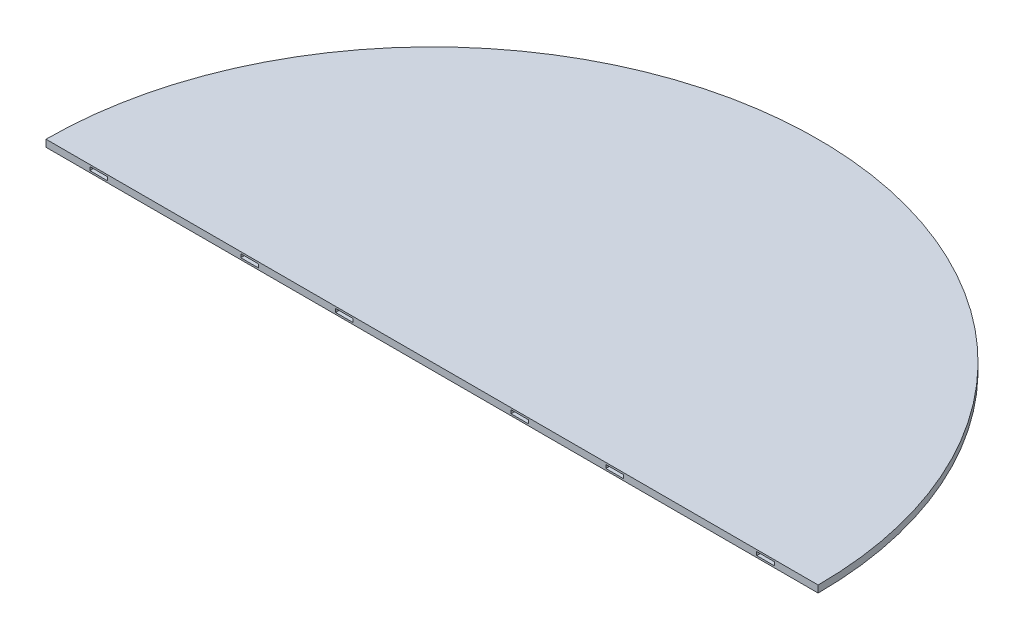
from build123d import *

# Parameters (mm, degrees)
BOSS_EXTRU_1_DEPTH                 = 20
CUSTOM_TUBE_CARRE_30_2_1_DEPTH     = 300.5
CUSTOM_TUBE_CARRE_30_2_1_2_DEPTH   = 300.5
CUSTOM_TUBE_CARRE_30_2_1_3_DEPTH   = 300.5
CUSTOM_TUBE_CARRE_35_2_5_1_DEPTH   = 350
CUSTOM_TUBE_CARRE_35_2_5_1_2_DEPTH = 350
CUSTOM_TUBE_CARRE_35_2_5_1_3_DEPTH = 350
ESQUISSE113_W                      = 50
ESQUISSE113_H                      = 10
ENL_V_MAT_EXTRU_1_DEPTH            = 10


with BuildPart() as part:
    # Esquisse1 → Boss.-Extru.1 (new body)
    with BuildSketch(Plane(origin=(0, 0, 0), x_dir=(1, 0, 0), z_dir=(0, 1, 0))):
        with BuildLine():
            Line((-1100, 0), (1100, 0))
            ThreePointArc((1100, 0), (0, 1100), (-1100, 0))
        make_face()
    extrude(amount=BOSS_EXTRU_1_DEPTH)

    # Esquisse113 → Enlèv. mat.-Extru.1 (cut)
    with BuildSketch(Plane.XY):
        with Locations((-950, 10)):
            Rectangle(ESQUISSE113_W, ESQUISSE113_H)
        with Locations((-520, 10)):
            Rectangle(ESQUISSE113_W, ESQUISSE113_H)
        with Locations((-250, 10)):
            Rectangle(ESQUISSE113_W, ESQUISSE113_H)
        with Locations((250, 10)):
            Rectangle(ESQUISSE113_W, ESQUISSE113_H)
        with Locations((520, 10)):
            Rectangle(ESQUISSE113_W, ESQUISSE113_H)
        with Locations((950, 10)):
            Rectangle(ESQUISSE113_W, ESQUISSE113_H)
    extrude(amount=-ENL_V_MAT_EXTRU_1_DEPTH, mode=Mode.SUBTRACT)


with BuildPart() as body_2:
    # Esquisse17 → Custom TUBE-CARRE-30-2(1) (new body)
    with BuildSketch(Plane(origin=(-601, -17.5, -560.75), x_dir=(-1, 0, 0), z_dir=(0, 0, 1))):
        with BuildLine():
            Line((-13, -15), (13, -15))
            ThreePointArc((13, -15), (14.414213562, -14.414213562), (15, -13))
            Line((15, -13), (15, 13))
            ThreePointArc((15, 13), (14.414213562, 14.414213562), (13, 15))
            Line((13, 15), (-13, 15))
            ThreePointArc((-13, 15), (-14.414213562, 14.414213562), (-15, 13))
            Line((-15, 13), (-15, -13))
            ThreePointArc((-15, -13), (-14.414213562, -14.414213562), (-13, -15))
        make_face()
        with BuildLine():
            Line((-11, -13), (11, -13))
            ThreePointArc((11, -13), (12.414213562, -12.414213562), (13, -11))
            Line((13, -11), (13, 11))
            ThreePointArc((13, 11), (12.414213562, 12.414213562), (11, 13))
            Line((11, 13), (-11, 13))
            ThreePointArc((-11, 13), (-12.414213562, 12.414213562), (-13, 11))
            Line((-13, 11), (-13, -11))
            ThreePointArc((-13, -11), (-12.414213562, -12.414213562), (-11, -13))
        make_face(mode=Mode.SUBTRACT)
    extrude(amount=CUSTOM_TUBE_CARRE_30_2_1_DEPTH)


with BuildPart() as body_3:
    # Esquisse17 on segment 2 (carried to segment 2) → Custom TUBE-CARRE-30-2_1 2 (new body)
    with BuildSketch(Plane(origin=(0, -17.5, -560.75), x_dir=(-1, 0, 0), z_dir=(0, 0, 1))):
        with BuildLine():
            Line((-13, -15), (13, -15))
            ThreePointArc((13, -15), (14.414213562, -14.414213562), (15, -13))
            Line((15, -13), (15, 13))
            ThreePointArc((15, 13), (14.414213562, 14.414213562), (13, 15))
            Line((13, 15), (-13, 15))
            ThreePointArc((-13, 15), (-14.414213562, 14.414213562), (-15, 13))
            Line((-15, 13), (-15, -13))
            ThreePointArc((-15, -13), (-14.414213562, -14.414213562), (-13, -15))
        make_face()
        with BuildLine():
            Line((-11, -13), (11, -13))
            ThreePointArc((11, -13), (12.414213562, -12.414213562), (13, -11))
            Line((13, -11), (13, 11))
            ThreePointArc((13, 11), (12.414213562, 12.414213562), (11, 13))
            Line((11, 13), (-11, 13))
            ThreePointArc((-11, 13), (-12.414213562, 12.414213562), (-13, 11))
            Line((-13, 11), (-13, -11))
            ThreePointArc((-13, -11), (-12.414213562, -12.414213562), (-11, -13))
        make_face(mode=Mode.SUBTRACT)
    extrude(amount=CUSTOM_TUBE_CARRE_30_2_1_2_DEPTH)


with BuildPart() as body_4:
    # Esquisse17 on segment 3 (carried to segment 3) → Custom TUBE-CARRE-30-2_1 3 (new body)
    with BuildSketch(Plane(origin=(601, -17.5, -560.75), x_dir=(-1, 0, 0), z_dir=(0, 0, 1))):
        with BuildLine():
            Line((-13, -15), (13, -15))
            ThreePointArc((13, -15), (14.414213562, -14.414213562), (15, -13))
            Line((15, -13), (15, 13))
            ThreePointArc((15, 13), (14.414213562, 14.414213562), (13, 15))
            Line((13, 15), (-13, 15))
            ThreePointArc((-13, 15), (-14.414213562, 14.414213562), (-15, 13))
            Line((-15, 13), (-15, -13))
            ThreePointArc((-15, -13), (-14.414213562, -14.414213562), (-13, -15))
        make_face()
        with BuildLine():
            Line((-11, -13), (11, -13))
            ThreePointArc((11, -13), (12.414213562, -12.414213562), (13, -11))
            Line((13, -11), (13, 11))
            ThreePointArc((13, 11), (12.414213562, 12.414213562), (11, 13))
            Line((11, 13), (-11, 13))
            ThreePointArc((-11, 13), (-12.414213562, 12.414213562), (-13, 11))
            Line((-13, 11), (-13, -11))
            ThreePointArc((-13, -11), (-12.414213562, -12.414213562), (-11, -13))
        make_face(mode=Mode.SUBTRACT)
    extrude(amount=CUSTOM_TUBE_CARRE_30_2_1_3_DEPTH)


with BuildPart() as body_5:
    # Esquisse111 → Custom TUBE-CARRE-35-2.5(1) (new body)
    with BuildSketch(Plane(origin=(-601, -17.5, -415.5), x_dir=(1, 0, 0), z_dir=(0, 0, -1))):
        with BuildLine():
            Line((-15.5, -17.5), (15.5, -17.5))
            ThreePointArc((15.5, -17.5), (16.914213562, -16.914213562), (17.5, -15.5))
            Line((17.5, -15.5), (17.5, 15.5))
            ThreePointArc((17.5, 15.5), (16.914213562, 16.914213562), (15.5, 17.5))
            Line((15.5, 17.5), (-15.5, 17.5))
            ThreePointArc((-15.5, 17.5), (-16.914213562, 16.914213562), (-17.5, 15.5))
            Line((-17.5, 15.5), (-17.5, -15.5))
            ThreePointArc((-17.5, -15.5), (-16.914213562, -16.914213562), (-15.5, -17.5))
        make_face()
        with BuildLine():
            Line((-13, -15), (13, -15))
            ThreePointArc((13, -15), (14.414213562, -14.414213562), (15, -13))
            Line((15, -13), (15, 13))
            ThreePointArc((15, 13), (14.414213562, 14.414213562), (13, 15))
            Line((13, 15), (-13, 15))
            ThreePointArc((-13, 15), (-14.414213562, 14.414213562), (-15, 13))
            Line((-15, 13), (-15, -13))
            ThreePointArc((-15, -13), (-14.414213562, -14.414213562), (-13, -15))
        make_face(mode=Mode.SUBTRACT)
    extrude(amount=CUSTOM_TUBE_CARRE_35_2_5_1_DEPTH)


with BuildPart() as body_6:
    # Esquisse111 on segment 2 (carried to segment 2) → Custom TUBE-CARRE-35-2.5_1 2 (new body)
    with BuildSketch(Plane(origin=(0, -17.5, -415.5), x_dir=(1, 0, 0), z_dir=(0, 0, -1))):
        with BuildLine():
            Line((-15.5, -17.5), (15.5, -17.5))
            ThreePointArc((15.5, -17.5), (16.914213562, -16.914213562), (17.5, -15.5))
            Line((17.5, -15.5), (17.5, 15.5))
            ThreePointArc((17.5, 15.5), (16.914213562, 16.914213562), (15.5, 17.5))
            Line((15.5, 17.5), (-15.5, 17.5))
            ThreePointArc((-15.5, 17.5), (-16.914213562, 16.914213562), (-17.5, 15.5))
            Line((-17.5, 15.5), (-17.5, -15.5))
            ThreePointArc((-17.5, -15.5), (-16.914213562, -16.914213562), (-15.5, -17.5))
        make_face()
        with BuildLine():
            Line((-13, -15), (13, -15))
            ThreePointArc((13, -15), (14.414213562, -14.414213562), (15, -13))
            Line((15, -13), (15, 13))
            ThreePointArc((15, 13), (14.414213562, 14.414213562), (13, 15))
            Line((13, 15), (-13, 15))
            ThreePointArc((-13, 15), (-14.414213562, 14.414213562), (-15, 13))
            Line((-15, 13), (-15, -13))
            ThreePointArc((-15, -13), (-14.414213562, -14.414213562), (-13, -15))
        make_face(mode=Mode.SUBTRACT)
    extrude(amount=CUSTOM_TUBE_CARRE_35_2_5_1_2_DEPTH)


with BuildPart() as body_7:
    # Esquisse111 on segment 3 (carried to segment 3) → Custom TUBE-CARRE-35-2.5_1 3 (new body)
    with BuildSketch(Plane(origin=(601, -17.5, -415.5), x_dir=(1, 0, 0), z_dir=(0, 0, -1))):
        with BuildLine():
            Line((-15.5, -17.5), (15.5, -17.5))
            ThreePointArc((15.5, -17.5), (16.914213562, -16.914213562), (17.5, -15.5))
            Line((17.5, -15.5), (17.5, 15.5))
            ThreePointArc((17.5, 15.5), (16.914213562, 16.914213562), (15.5, 17.5))
            Line((15.5, 17.5), (-15.5, 17.5))
            ThreePointArc((-15.5, 17.5), (-16.914213562, 16.914213562), (-17.5, 15.5))
            Line((-17.5, 15.5), (-17.5, -15.5))
            ThreePointArc((-17.5, -15.5), (-16.914213562, -16.914213562), (-15.5, -17.5))
        make_face()
        with BuildLine():
            Line((-13, -15), (13, -15))
            ThreePointArc((13, -15), (14.414213562, -14.414213562), (15, -13))
            Line((15, -13), (15, 13))
            ThreePointArc((15, 13), (14.414213562, 14.414213562), (13, 15))
            Line((13, 15), (-13, 15))
            ThreePointArc((-13, 15), (-14.414213562, 14.414213562), (-15, 13))
            Line((-15, 13), (-15, -13))
            ThreePointArc((-15, -13), (-14.414213562, -14.414213562), (-13, -15))
        make_face(mode=Mode.SUBTRACT)
    extrude(amount=CUSTOM_TUBE_CARRE_35_2_5_1_3_DEPTH)


solid = Compound([part.part, body_2.part, body_3.part, body_4.part, body_5.part, body_6.part, body_7.part])
